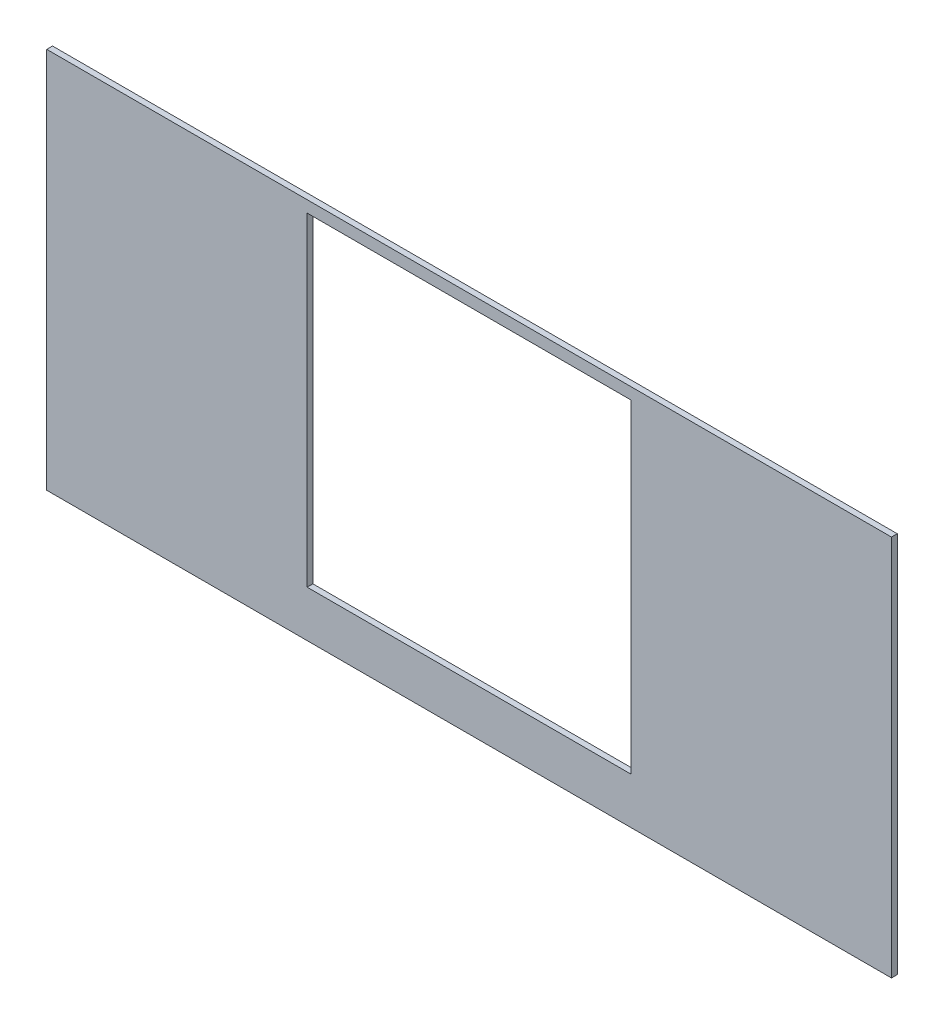
from build123d import *

# Parameters (mm, degrees)
CROQUIS2_W              = 730
CROQUIS2_H              = 330
SALIENTE_EXTRUIR2_DEPTH = 5
CROQUIS4_W              = 280
CROQUIS4_H              = 280
CORTAR_EXTRUIR1_DEPTH   = 5


with BuildPart() as part:
    # Croquis2 → Saliente-Extruir2 (new body)
    with BuildSketch(Plane.XY):
        Rectangle(CROQUIS2_W, CROQUIS2_H)
    extrude(amount=SALIENTE_EXTRUIR2_DEPTH)

    # Croquis4 → Cortar-Extruir1 (cut)
    with BuildSketch(Plane.XY.offset(5)):
        with Locations((0, 15)):
            Rectangle(CROQUIS4_W, CROQUIS4_H)
    extrude(amount=-CORTAR_EXTRUIR1_DEPTH, mode=Mode.SUBTRACT)


solid = part.part
